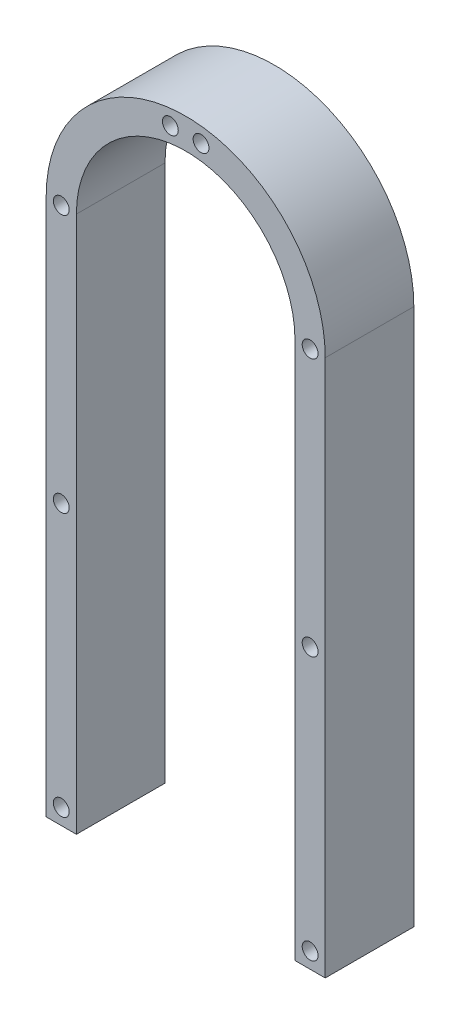
from build123d import *

# Parameters (mm, degrees)
BOSS_EXTRUDE1_DEPTH = 19.05
SKETCH2_R           = 1.7
CUT_EXTRUDE1_DEPTH  = 302.810637772
CUT_EXTRUDE2_DEPTH  = 302.810637772


with BuildPart() as part:
    # Sketch1 → Boss-Extrude1 (new body)
    with BuildSketch(Plane.XY):
        with BuildLine():
            Line((-179.085368151, -18.789194183), (-179.085368151, 212.188334746))
            ThreePointArc((-179.085368151, 212.188334746), (-149.085368151, 242.188334746), (-119.085368151, 212.188334746))
            Line((-119.085368151, 212.188334746), (-119.085368151, -18.789194183))
            ThreePointArc((-119.085368151, -18.789194183), (-149.085368151, -48.789194183), (-179.085368151, -18.789194183))
        make_face()
        with BuildLine():
            Line((-172.585368151, -18.789194183), (-172.585368151, 212.188334746))
            ThreePointArc((-172.585368151, 212.188334746), (-149.085368151, 235.688334746), (-125.585368151, 212.188334746))
            Line((-125.585368151, 212.188334746), (-125.585368151, -18.789194183))
            ThreePointArc((-125.585368151, -18.789194183), (-149.085368151, -42.289194183), (-172.585368151, -18.789194183))
        make_face(mode=Mode.SUBTRACT)
    extrude(amount=BOSS_EXTRUDE1_DEPTH)

    # Sketch2 → Cut-Extrude1 (cut, through all)
    with BuildSketch(Plane.XY.offset(19.05)):
        with Locations((-145.785368151, 238.734002942)):
            Circle(SKETCH2_R)
        with Locations((-122.335368151, 212.188334746)):
            Circle(SKETCH2_R)
        with Locations((-152.485368151, -45.322239617)):
            Circle(SKETCH2_R)
        with Locations((-168.000474547, -37.70430058)):
            Circle(SKETCH2_R)
        with Locations((-175.835368151, -18.789194183)):
            Circle(SKETCH2_R)
        with Locations((-175.835368151, 212.188334746)):
            Circle(SKETCH2_R)
        with Locations((-145.685368151, -45.322239617)):
            Circle(SKETCH2_R)
        with Locations((-175.835368151, 100.099570281)):
            Circle(SKETCH2_R)
        with Locations((-175.835368151, 93.299570281)):
            Circle(SKETCH2_R)
        with Locations((-122.335368151, 100.099570281)):
            Circle(SKETCH2_R)
        with Locations((-122.335368151, 93.299570281)):
            Circle(SKETCH2_R)
        with Locations((-122.335368151, -18.789194183)):
            Circle(SKETCH2_R)
        with Locations((-130.170261754, -37.70430058)):
            Circle(SKETCH2_R)
        with Locations((-175.835368151, 156.699570281)):
            Circle(SKETCH2_R)
        with Locations((-122.335368151, 156.699570281)):
            Circle(SKETCH2_R)
        with Locations((-175.835368151, 66.699570281)):
            Circle(SKETCH2_R)
        with Locations((-122.335368151, 66.699570281)):
            Circle(SKETCH2_R)
        with Locations((-175.835368151, 36.699570281)):
            Circle(SKETCH2_R)
        with Locations((-122.335368151, 36.699570281)):
            Circle(SKETCH2_R)
        with Locations((-175.835368151, 6.699570281)):
            Circle(SKETCH2_R)
        with Locations((-122.335368151, 6.699570281)):
            Circle(SKETCH2_R)
        with Locations((-152.385368151, 238.734002942)):
            Circle(SKETCH2_R)
    extrude(amount=-CUT_EXTRUDE1_DEPTH, mode=Mode.SUBTRACT)

    # Sketch3 → Cut-Extrude2 (cut, through all)
    with BuildSketch(Plane.XY.offset(19.05)):
        Polygon((-149.085368151, 96.699570281), (-100.167336626, 96.699570281), (-100.167336626, -59.171887956), (-212.527814826, -59.171887956), (-212.527814826, 96.699570281), align=None)
    extrude(amount=-CUT_EXTRUDE2_DEPTH, mode=Mode.SUBTRACT)


solid = part.part
